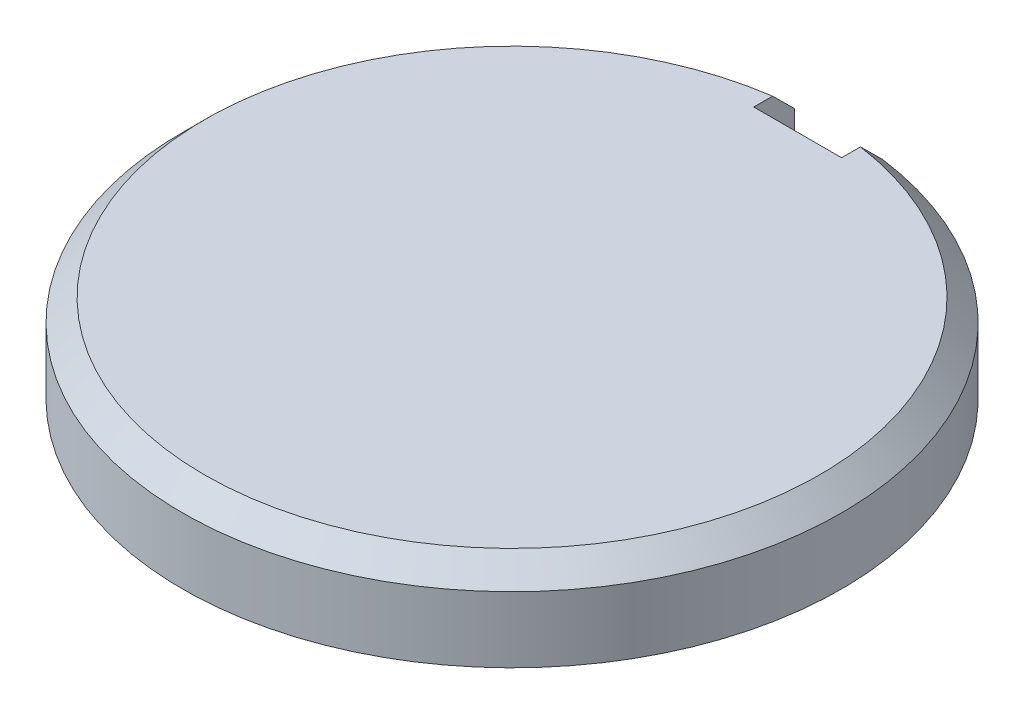
from build123d import *

# Parameters (mm, degrees)
BOSS_EXTRUDE1_START = -65.2
SKETCH2_W           = 0.8
SKETCH2_H           = 1.28
BOSS_EXTRUDE1_DEPTH = 6.4
BOSS_EXTRUDE2_START = -62.4
SKETCH3_W           = 6.4
SKETCH3_H           = 1.28
BOSS_EXTRUDE2_DEPTH = 0.8
BOSS_EXTRUDE3_START = -68.1
SKETCH4_W           = 1.6
SKETCH4_H           = 1.8
BOSS_EXTRUDE3_DEPTH = 0.9


with BuildPart() as part:
    # Sketch1 → Revolve1 (revolve)
    with BuildSketch(Plane.XY.offset(-62)):
        Polygon((2.3, 49.4), (2.3, 50.6), (0, 50.6), (0, 52.2), (5.6, 52.2), (6, 51.8), (6, 50.6), (3, 50.6), (3, 49.4), align=None)
    revolve(axis=Axis((0, 44.4, -62), (0, 1, 0)))


with BuildPart() as body_2:
    # Sketch2 → Boss-Extrude1 (new body)
    with BuildSketch(Plane.XY.offset(BOSS_EXTRUDE1_START)):
        with Locations((0, 49.94)):
            Rectangle(SKETCH2_W, SKETCH2_H)
    extrude(amount=BOSS_EXTRUDE1_DEPTH)


with BuildPart() as part_1:
    add(part.part)

    # Combine1: cut body 2
    add(body_2.part, mode=Mode.SUBTRACT)


with BuildPart() as body_2_2:
    # Sketch3 → Boss-Extrude2 (new body)
    with BuildSketch(Plane.XY.offset(BOSS_EXTRUDE2_START)):
        with Locations((0, 49.94)):
            Rectangle(SKETCH3_W, SKETCH3_H)
    extrude(amount=BOSS_EXTRUDE2_DEPTH)


with BuildPart() as part_2:
    add(part_1.part)

    # Combine2: cut body 2 2
    add(body_2_2.part, mode=Mode.SUBTRACT)


with BuildPart() as body_2_3:
    # Sketch4 → Boss-Extrude3 (new body)
    with BuildSketch(Plane.XY.offset(BOSS_EXTRUDE3_START)):
        with Locations((0, 51.4)):
            Rectangle(SKETCH4_W, SKETCH4_H)
    extrude(amount=BOSS_EXTRUDE3_DEPTH)


with BuildPart() as part_3:
    add(part_2.part)

    # Combine3: cut body 2 3
    add(body_2_3.part, mode=Mode.SUBTRACT)


solid = part_3.part
